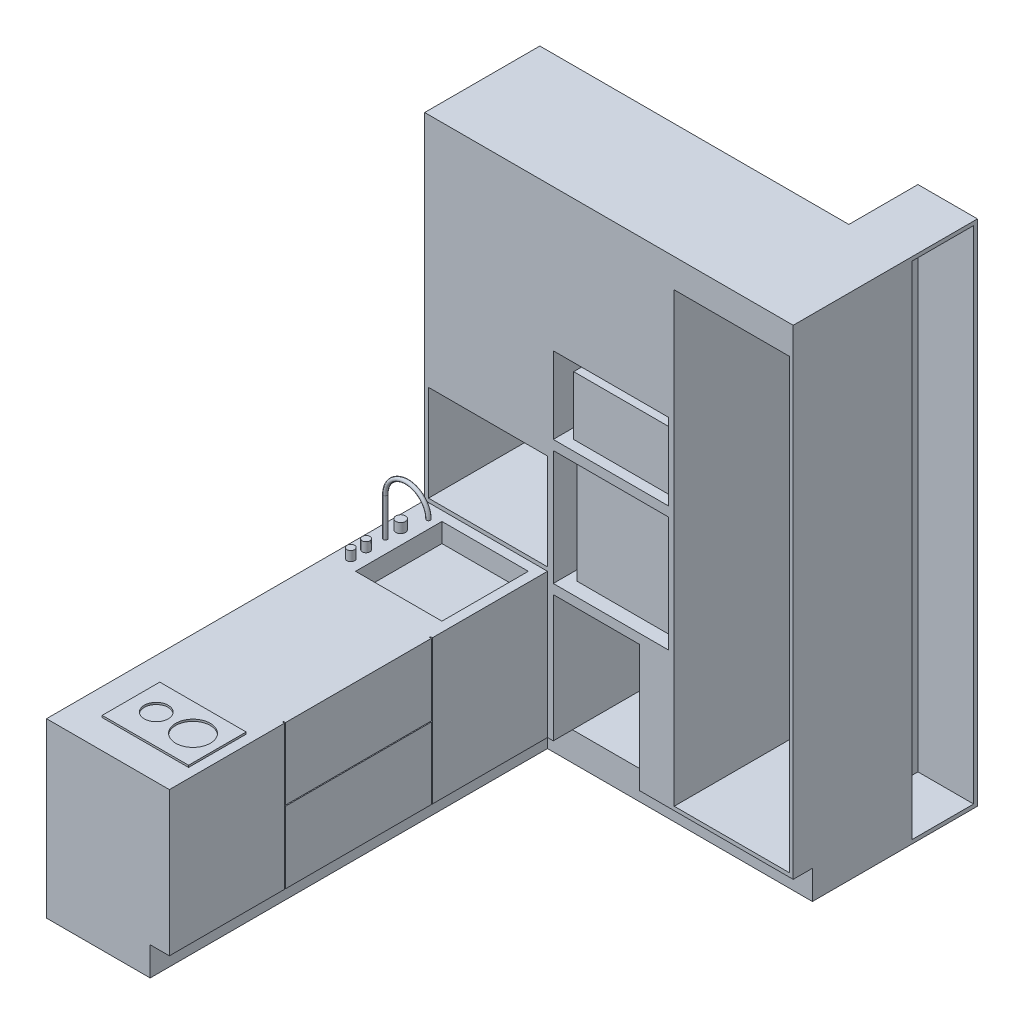
from build123d import *

# Parameters (mm, degrees)
EXTRUDE_1_DEPTH      = 900
EXTRUDE_2_DEPTH      = 1750
CUT_EXTRUDE_1_DEPTH  = 150
SKETCH_5_W           = 600
SKETCH_5_H           = 2330
CUT_EXTRUDE_3_DEPTH  = 600
CUT_EXTRUDE_4_REACH  = 3821.66
SKETCH_6_W           = 450
SKETCH_6_H           = 660
SKETCH_7_W           = 600
SKETCH_7_H           = 600
CUT_EXTRUDE_5_DEPTH  = 600
SKETCH_8_W           = 600
SKETCH_8_H           = 400
CUT_EXTRUDE_6_DEPTH  = 600
SKETCH_9_W           = 320
SKETCH_9_H           = 2610
CUT_EXTRUDE_7_DEPTH  = 290
SKETCH_10_W          = 450
SKETCH_10_H          = 450
CUT_EXTRUDE_8_DEPTH  = 100
SKETCH_11_W          = 620
SKETCH_11_H          = 500
CUT_EXTRUDE_9_DEPTH  = 580
SKETCH_12_W          = 450
SKETCH_12_H          = 300
EXTRUDE_3_DEPTH      = 10
SKETCH_13_R          = 62.030124837
SKETCH_13_R_2        = 90.202132014
CUT_EXTRUDE_10_DEPTH = 10
CUT_EXTRUDE_11_DEPTH = 10
SWEEP_1_PROFILE_R    = 10
SKETCH_21_R          = 20
SKETCH_21_R_2        = 25
EXTRUDE_4_DEPTH      = 50
SKETCH_22_W          = 510.923596237
SKETCH_22_H          = 258.513078401
EXTRUDE_5_DEPTH      = 306
SKETCH_23_W          = 500.401819184
SKETCH_23_H          = 428.934094681
EXTRUDE_6_DEPTH      = 560


with BuildPart() as part:
    # Эскиз1 → Бобышка-Вытянуть1 (new body)
    with BuildSketch(Plane(origin=(0, 0, 0), x_dir=(1, 0, 0), z_dir=(0, 1, 0))):
        Polygon((-310, 0), (-1920, 0), (-1920, -2570), (-1280, -2570), (-1280, -600), (0, -600), (0, 0), (0, 360), (-310, 360), align=None)
    extrude(amount=EXTRUDE_1_DEPTH)

    # Эскиз2 → Бобышка-Вытянуть2 (add)
    with BuildSketch(Plane(origin=(0, 900, 0), x_dir=(1, 0, 0), z_dir=(0, 1, 0))):
        Polygon((-1920, 0), (-310, 0), (-310, 360), (0, 360), (0, -600), (-1920, -600), align=None)
    extrude(amount=EXTRUDE_2_DEPTH)

    # Эскиз4 → Вырез-Вытянуть1 (cut)
    with BuildSketch(Plane(origin=(0, 0, 0), x_dir=(-1, 0, 0), z_dir=(0, -1, 0))):
        Polygon((1280, -2570), (1380, -2570), (1380, -500), (0, -500), (0, -600), (1280, -600), align=None)
    extrude(amount=-CUT_EXTRUDE_1_DEPTH, mode=Mode.SUBTRACT)

    # Эскиз5 → Вырез-Вытянуть3 (cut)
    with BuildSketch(Plane.XY.offset(600)):
        with Locations((-320, 1335)):
            Rectangle(SKETCH_5_W, SKETCH_5_H)
    extrude(amount=-CUT_EXTRUDE_3_DEPTH, mode=Mode.SUBTRACT)

    # Вырез-Вытянуть4: up to this face of the body (flat: up to its plane)
    cut_extrude_4_end = Plane(part.part.faces().sort_by_distance((-1247.46854015, 1322.962022459, 0))[0])
    # Эскиз6 → Вырез-Вытянуть4 (cut, up to the picked face)
    with BuildSketch(Plane.XY.offset(600), mode=Mode.PRIVATE) as cut_extrude_4_sk1:
        with Locations((-1025, 480)):
            Rectangle(SKETCH_6_W, SKETCH_6_H)
    cut_extrude_4_tool1 = split(extrude(cut_extrude_4_sk1.sketch, amount=-CUT_EXTRUDE_4_REACH, mode=Mode.PRIVATE), bisect_by=cut_extrude_4_end, keep=Keep.BOTH, mode=Mode.PRIVATE)
    add(cut_extrude_4_tool1.solids().sort_by(Axis((-1025, 480, 600), (0, 0, -1)))[0], mode=Mode.SUBTRACT)

    # Эскиз7 → Вырез-Вытянуть5 (cut)
    with BuildSketch(Plane.XY.offset(600)):
        with Locations((-950, 1160)):
            Rectangle(SKETCH_7_W, SKETCH_7_H)
    extrude(amount=-CUT_EXTRUDE_5_DEPTH, mode=Mode.SUBTRACT)

    # Эскиз8 → Вырез-Вытянуть6 (cut)
    with BuildSketch(Plane.XY.offset(600)):
        with Locations((-950, 1710)):
            Rectangle(SKETCH_8_W, SKETCH_8_H)
    extrude(amount=-CUT_EXTRUDE_6_DEPTH, mode=Mode.SUBTRACT)

    # Эскиз9 → Вырез-Вытянуть7 (cut)
    with BuildSketch(Plane(origin=(0, 0, 0), x_dir=(0, 0, -1), z_dir=(1, 0, 0))):
        with Locations((180, 1325)):
            Rectangle(SKETCH_9_W, SKETCH_9_H)
    extrude(amount=-CUT_EXTRUDE_7_DEPTH, mode=Mode.SUBTRACT)

    # Эскиз10 → Вырез-Вытянуть8 (cut)
    with BuildSketch(Plane(origin=(0, 900, 0), x_dir=(1, 0, 0), z_dir=(0, 1, 0))):
        with Locations((-1555, -875)):
            Rectangle(SKETCH_10_W, SKETCH_10_H)
    extrude(amount=-CUT_EXTRUDE_8_DEPTH, mode=Mode.SUBTRACT)

    # Эскиз11 → Вырез-Вытянуть9 (cut)
    with BuildSketch(Plane.XY.offset(600)):
        with Locations((-1590, 1170)):
            Rectangle(SKETCH_11_W, SKETCH_11_H)
    extrude(amount=-CUT_EXTRUDE_9_DEPTH, mode=Mode.SUBTRACT)

    # Эскиз12 → Бобышка-Вытянуть3 (add)
    with BuildSketch(Plane(origin=(0, 900, 0), x_dir=(1, 0, 0), z_dir=(0, 1, 0))):
        with Locations((-1555, -2270)):
            Rectangle(SKETCH_12_W, SKETCH_12_H)
    extrude(amount=EXTRUDE_3_DEPTH)

    # Эскиз13 → Вырез-Вытянуть10 (cut)
    with BuildSketch(Plane(origin=(0, 910, 0), x_dir=(1, 0, 0), z_dir=(0, 1, 0))):
        with Locations(Location((-1654.208045563, -2264.249851764, 0), (0, 0, 270))):
            Circle(SKETCH_13_R)
        with Locations(Location((-1462.546999968, -2264.249851764, 0), (0, 0, 270))):
            Circle(SKETCH_13_R_2)
    extrude(amount=-CUT_EXTRUDE_10_DEPTH, mode=Mode.SUBTRACT)

    # Эскиз14 → Вырез-Вытянуть11 (cut)
    with BuildSketch(Plane(origin=(-1280, 0, 0), x_dir=(0, 0, -1), z_dir=(1, 0, 0))):
        Polygon((-1970, 900), (-1965, 900), (-1965, 527.5), (-1205, 527.5), (-1205, 900), (-1200, 900), (-1200, 150), (-1205, 150), (-1205, 522.5), (-1965, 522.5), (-1965, 150), (-1970, 150), align=None)
    extrude(amount=-CUT_EXTRUDE_11_DEPTH, mode=Mode.SUBTRACT)

    # По траектории1: sweep along a curve in space
    with BuildLine() as sweep_1_path:
        Line((-1850, 900, 875), (-1850, 1100, 875))
        ThreePointArc((-1850, 1100, 875), (-1737.5, 1212.5, 875), (-1625, 1100, 875))
    # По траектории1 profile (on start of the path) → По траектории1 (sweep)
    with BuildSketch(Plane(origin=(-1850, 900, 875), x_dir=(0, 0, 1), z_dir=(0, 1, 0))):
        Circle(SWEEP_1_PROFILE_R)
    sweep(path=sweep_1_path.line)

    # Эскиз21 → Бобышка-Вытянуть4 (add)
    with BuildSketch(Plane(origin=(0, 900, 0), x_dir=(1, 0, 0), z_dir=(0, 1, 0))):
        with Locations(Location((-1850, -975, 0), (0, 0, 270))):
            Circle(SKETCH_21_R)
        with Locations(Location((-1850, -1055, 0), (0, 0, 270))):
            Circle(SKETCH_21_R)
        with Locations(Location((-1850, -795, 0), (0, 0, 270))):
            Circle(SKETCH_21_R_2)
    extrude(amount=EXTRUDE_4_DEPTH)

    # Эскиз22 → Бобышка-Вытянуть5 (add)
    with BuildSketch(Plane(origin=(0, 1510, 0), x_dir=(1, 0, 0), z_dir=(0, 1, 0))):
        with Locations((-941.007183296, -417.787145218)):
            Rectangle(SKETCH_22_W, SKETCH_22_H)
    extrude(amount=EXTRUDE_5_DEPTH)

    # Эскиз23 → Бобышка-Вытянуть6 (add)
    with BuildSketch(Plane(origin=(0, 860, 0), x_dir=(1, 0, 0), z_dir=(0, 1, 0))):
        with Locations((-948.304788949, -313.419513713)):
            Rectangle(SKETCH_23_W, SKETCH_23_H)
    extrude(amount=EXTRUDE_6_DEPTH)


solid = part.part
